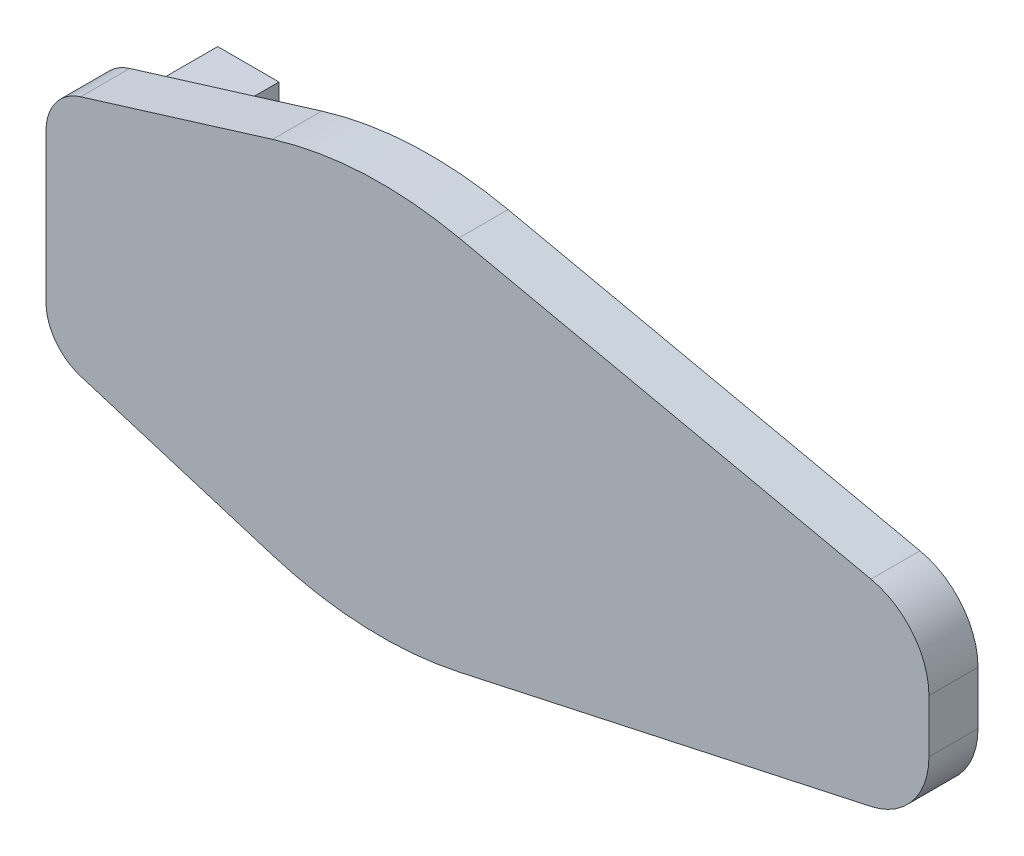
from build123d import *

# Parameters (mm, degrees)
BOSS_EXTRUDE1_DEPTH = 4
SKETCH2_W           = 5
SKETCH2_H           = 10
BOSS_EXTRUDE2_DEPTH = 10
CUT_EXTRUDE1_REACH  = 71.609
SKETCH3_R           = 1.55


with BuildPart() as part:
    # Sketch1 → Boss-Extrude1 (new body)
    with BuildSketch(Plane.XY):
        with BuildLine():
            Line((2.823656605, 9.868817417), (18.486372689, 14.688114674))
            ThreePointArc((18.486372689, 14.688114674), (26.042750669, 15.988011567), (33.681837484, 15.33003533))
            Line((33.681837484, 15.33003533), (67.274577866, 8.027265681))
            ThreePointArc((67.274577866, 8.027265681), (70.67158791, 5.929345796), (72, 2.164207498))
            Line((72, 2.164207498), (72, -2.164207498))
            ThreePointArc((72, -2.164207498), (70.67158791, -5.929345796), (67.274577866, -8.027265681))
            Line((67.274577866, -8.027265681), (33.681837484, -15.33003533))
            ThreePointArc((33.681837484, -15.33003533), (26.042750669, -15.988011567), (18.486372689, -14.688114674))
            Line((18.486372689, -14.688114674), (2.823656605, -9.868817417))
            ThreePointArc((2.823656605, -9.868817417), (0.782440864, -8.422109009), (0, -6.045701382))
            Line((0, -6.045701382), (0, 6.045701382))
            ThreePointArc((0, 6.045701382), (0.782440864, 8.422109009), (2.823656605, 9.868817417))
        make_face()
    extrude(amount=BOSS_EXTRUDE1_DEPTH)

    # Sketch2 → Boss-Extrude2 (add)
    with BuildSketch(Plane(origin=(0, 0, 0), x_dir=(-1, 0, 0), z_dir=(0, 0, -1))):
        with Locations((-2.5, 0)):
            Rectangle(SKETCH2_W, SKETCH2_H)
    extrude(amount=BOSS_EXTRUDE2_DEPTH)

    # Sketch3 → Cut-Extrude1 (cut, up to next)
    with BuildSketch(Plane(origin=(5, 0, 0), x_dir=(0, 0, -1), z_dir=(1, 0, 0)), mode=Mode.PRIVATE) as cut_extrude1_sk1:
        with Locations((5, 0)):
            Circle(SKETCH3_R)
    cut_extrude1_tool1 = extrude(cut_extrude1_sk1.sketch, amount=-CUT_EXTRUDE1_REACH, mode=Mode.PRIVATE) & part.part
    add(cut_extrude1_tool1.solids().sort_by_distance((5, 0, -5))[0], mode=Mode.SUBTRACT)


solid = part.part
